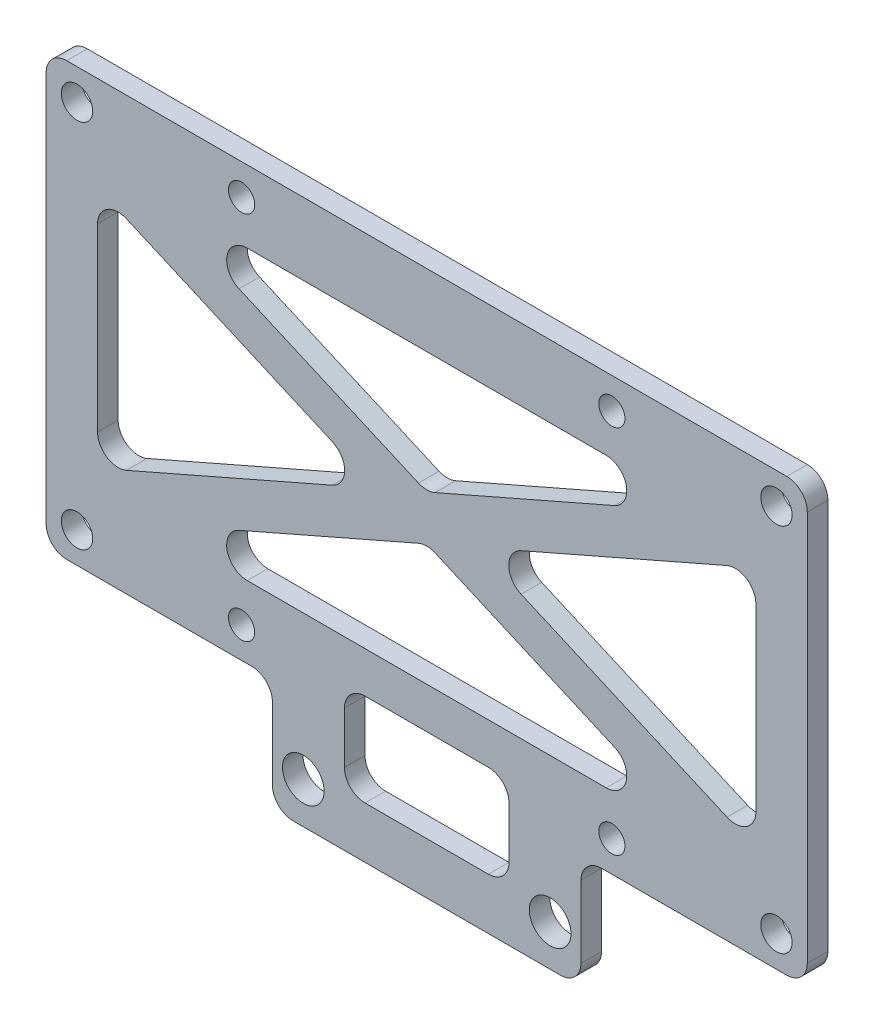
from build123d import *

# Parameters (mm, degrees)
SKETCH_1_W          = 74
SKETCH_1_H          = 42
SKETCH_1_R          = 1.275
EXTRUDE_1_DEPTH     = 2
SKETCH_2_R          = 1.525
CUT_EXTRUDE_1_DEPTH = 2
FILLET_1_R          = 2
SKETCH_3_W          = 30
SKETCH_3_H          = 22
EXTRUDE_2_DEPTH     = 2
SKETCH_4_R          = 2.025
CUT_EXTRUDE_2_DEPTH = 10
FILLET_2_R          = 2
CUT_EXTRUDE_3_DEPTH = 10
SKETCH_6_W          = 16
SKETCH_6_H          = 9
CUT_EXTRUDE_4_DEPTH = 10
FILLET_3_R          = 2


with BuildPart() as part:
    # 草图1 → 凸台-拉伸1 (new body)
    with BuildSketch(Plane.XY):
        Rectangle(SKETCH_1_W, SKETCH_1_H)
        with Locations((18, 18)):
            Circle(SKETCH_1_R, mode=Mode.SUBTRACT)
        with Locations((-18, 18)):
            Circle(SKETCH_1_R, mode=Mode.SUBTRACT)
        with Locations((-18, -18)):
            Circle(SKETCH_1_R, mode=Mode.SUBTRACT)
        with Locations((18, -18)):
            Circle(SKETCH_1_R, mode=Mode.SUBTRACT)
    extrude(amount=EXTRUDE_1_DEPTH)

    # 草图2 → 切除-拉伸1 (cut)
    with BuildSketch(Plane.XY.offset(2)):
        with Locations((34, 18)):
            Circle(SKETCH_2_R)
        with Locations((-34, 18)):
            Circle(SKETCH_2_R)
        with Locations((-34, -18)):
            Circle(SKETCH_2_R)
        with Locations((34, -18)):
            Circle(SKETCH_2_R)
    extrude(amount=-CUT_EXTRUDE_1_DEPTH, mode=Mode.SUBTRACT)

    # 圆角1
    fillet_1_edges = [part.edges().sort_by_distance(p)[0] for p in [
        (37, -21, 1),
        (-37, -21, 1),
        (-37, 21, 1),
        (37, 21, 1),
    ]]
    fillet(fillet_1_edges, radius=FILLET_1_R)

    # 草图3 → 凸台-拉伸2 (add)
    with BuildSketch(Plane.XY.offset(2)):
        with Locations((0, -21)):
            Rectangle(SKETCH_3_W, SKETCH_3_H)
    extrude(amount=-EXTRUDE_2_DEPTH)

    # 草图4 → 切除-拉伸2 (cut)
    with BuildSketch(Plane.XY.offset(2)):
        with Locations((12, -28)):
            Circle(SKETCH_4_R)
        with Locations((-12, -28)):
            Circle(SKETCH_4_R)
    extrude(amount=-CUT_EXTRUDE_2_DEPTH, mode=Mode.SUBTRACT)

    # 圆角2
    fillet_2_edges = [part.edges().sort_by_distance(p)[0] for p in [
        (15, -21, 1),
        (-15, -21, 1),
        (-15, -32, 1),
        (15, -32, 1),
    ]]
    fillet(fillet_2_edges, radius=FILLET_2_R)

    # 草图5 → 切除-拉伸3 (cut)
    with BuildSketch(Plane(origin=(0, 0, 0), x_dir=(-1, 0, 0), z_dir=(0, 0, -1))):
        Polygon((0, -2.18303115), (-27.010214515, -14), (27.010214515, -14), align=None)
        Polygon((-32, 11.81696885), (-32, -11.81696885), (-4.989785485, 0), align=None)
        Polygon((-27.010214515, 14), (0, 2.18303115), (27.010214515, 14), align=None)
        Polygon((32, 11.81696885), (4.989785485, 0), (32, -11.81696885), align=None)
    extrude(amount=-CUT_EXTRUDE_3_DEPTH, mode=Mode.SUBTRACT)

    # 草图6 → 切除-拉伸4 (cut)
    with BuildSketch(Plane(origin=(0, 0, 0), x_dir=(-1, 0, 0), z_dir=(0, 0, -1))):
        with Locations((0, -22.5)):
            Rectangle(SKETCH_6_W, SKETCH_6_H)
    extrude(amount=-CUT_EXTRUDE_4_DEPTH, mode=Mode.SUBTRACT)

    # 圆角3
    fillet_3_edges = [part.edges().sort_by_distance(p)[0] for p in [
        (0, 2.18303115, 1),
        (27.010214515, 14, 1),
        (-27.010214515, 14, 1),
        (32, -11.81696885, 1),
        (32, 11.81696885, 1),
        (4.989785485, 0, 1),
        (-4.989785485, 0, 1),
        (-32, 11.81696885, 1),
        (-32, -11.81696885, 1),
        (27.010214515, -14, 1),
        (0, -2.18303115, 1),
        (-27.010214515, -14, 1),
        (-8, -18, 1),
        (-8, -27, 1),
        (8, -27, 1),
        (8, -18, 1),
    ]]
    fillet(fillet_3_edges, radius=FILLET_3_R)


solid = part.part
